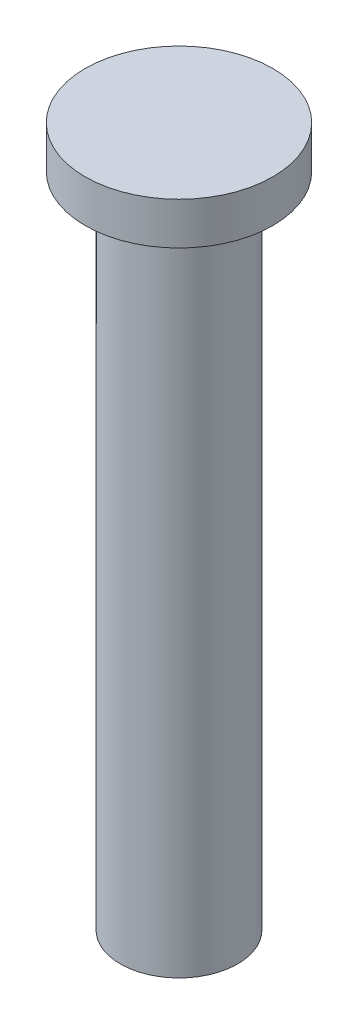
from build123d import *


with BuildPart() as part:
    # 草图1 → 旋转1 (revolve)
    with BuildSketch(Plane.XY, mode=Mode.PRIVATE) as revolve_1_sk:
        Polygon((0, 0), (0, -14.9), (1.25, -14.9), (1.25, -0.9), (2, -0.9), (2, 0), align=None)
    revolve(revolve_1_sk.sketch.rotate(Axis((0, 0, 0), (0, -1, 0)), 180), axis=Axis((0, 0, 0), (0, -1, 0)))


solid = part.part
